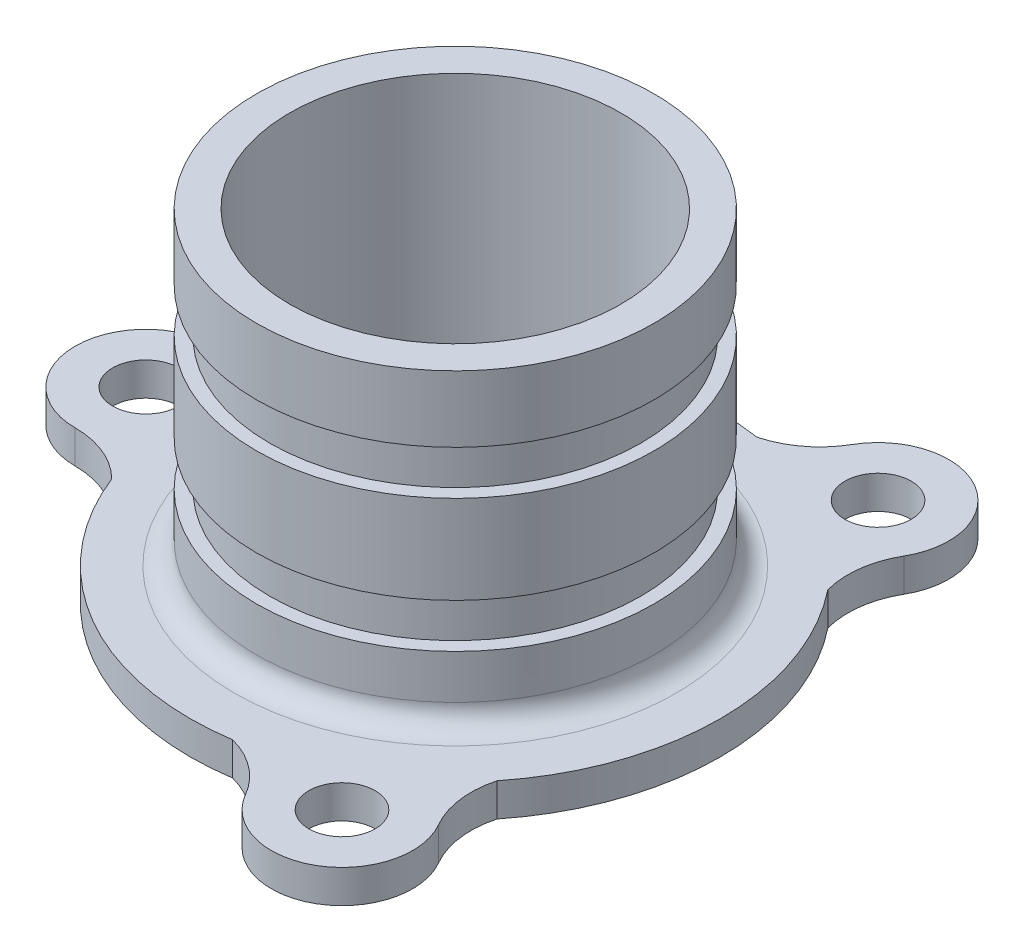
from build123d import *

# Parameters (mm, degrees)
SKETCH2_R           = 37.5
SKETCH2_R_2         = 7.5
BOSS_EXTRUDE1_DEPTH = 7.5
SKETCH3_R           = 45
SKETCH3_R_2         = 37.5
BOSS_EXTRUDE2_DEPTH = 15
SKETCH4_R           = 42
SKETCH4_R_2         = 37.5
BOSS_EXTRUDE3_DEPTH = 10
SKETCH5_R           = 45
SKETCH5_R_2         = 42
SKETCH5_R_3         = 37.5
BOSS_EXTRUDE4_DEPTH = 20
SKETCH6_R           = 42
SKETCH6_R_2         = 37.5
BOSS_EXTRUDE5_DEPTH = 10
SKETCH7_R           = 45
SKETCH7_R_2         = 37.5
BOSS_EXTRUDE6_DEPTH = 15
FILLET1_R           = 5


with BuildPart() as part:
    # Sketch2 → Boss-Extrude1 (new body)
    with BuildSketch(Plane(origin=(0, 0, 0), x_dir=(1, 0, 0), z_dir=(0, 1, 0))):
        with BuildLine():
            ThreePointArc((8.95472604, 59.328010935), (-30, 51.961524227), (-55.856927646, 21.908985233))
            ThreePointArc((-55.856927646, 21.908985233), (-62.363007589, 17.536247736), (-70.05, 16))
            ThreePointArc((-70.05, 16), (-86.05, 0), (-70.05, -16))
            ThreePointArc((-70.05, -16), (-62.363007589, -17.536247736), (-55.856927646, -21.908985233))
            ThreePointArc((-55.856927646, -21.908985233), (-30, -51.961524227), (8.95472604, -59.328010935))
            ThreePointArc((8.95472604, -59.328010935), (15.994667768, -62.776072696), (21.168593539, -68.665079535))
            ThreePointArc((21.168593539, -68.665079535), (43.025, -74.521485996), (48.881406461, -52.665079535))
            ThreePointArc((48.881406461, -52.665079535), (46.368339821, -45.23982496), (46.902201606, -37.419025702))
            ThreePointArc((46.902201606, -37.419025702), (60, 0), (46.902201606, 37.419025702))
            ThreePointArc((46.902201606, 37.419025702), (46.368339821, 45.23982496), (48.881406461, 52.665079535))
            ThreePointArc((48.881406461, 52.665079535), (43.025, 74.521485996), (21.168593539, 68.665079535))
            ThreePointArc((21.168593539, 68.665079535), (15.994667768, 62.776072696), (8.95472604, 59.328010935))
        make_face()
        with Locations(Location((0, 0, 0), (0, 0, 270))):
            Circle(SKETCH2_R, mode=Mode.SUBTRACT)
        with Locations(Location((-70.05, 0, 0), (0, 0, 270))):
            Circle(SKETCH2_R_2, mode=Mode.SUBTRACT)
        with Locations(Location((35.025, 60.665079535, 0), (0, 0, 270))):
            Circle(SKETCH2_R_2, mode=Mode.SUBTRACT)
        with Locations(Location((35.025, -60.665079535, 0), (0, 0, 270))):
            Circle(SKETCH2_R_2, mode=Mode.SUBTRACT)
    extrude(amount=BOSS_EXTRUDE1_DEPTH)

    # Sketch3 → Boss-Extrude2 (add)
    with BuildSketch(Plane(origin=(0, 7.5, 0), x_dir=(1, 0, 0), z_dir=(0, 1, 0))):
        with Locations(Location((0, 0, 0), (0, 0, 90))):
            Circle(SKETCH3_R)
        with Locations(Location((0, 0, 0), (0, 0, 270))):
            Circle(SKETCH3_R_2, mode=Mode.SUBTRACT)
    extrude(amount=BOSS_EXTRUDE2_DEPTH)

    # Sketch4 → Boss-Extrude3 (add)
    with BuildSketch(Plane(origin=(0, 22.5, 0), x_dir=(1, 0, 0), z_dir=(0, 1, 0))):
        with Locations(Location((0, 0, 0), (0, 0, 270))):
            Circle(SKETCH4_R)
        with Locations(Location((0, 0, 0), (0, 0, 270))):
            Circle(SKETCH4_R_2, mode=Mode.SUBTRACT)
    extrude(amount=BOSS_EXTRUDE3_DEPTH)

    # Sketch5 → Boss-Extrude4 (add)
    # profile 1 of 2: a face of its own
    with BuildSketch(Plane(origin=(0, 32.5, 0), x_dir=(1, 0, 0), z_dir=(0, 1, 0))):
        with Locations(Location((0, 0, 0), (0, 0, 90))):
            Circle(SKETCH5_R)
        with Locations(Location((0, 0, 0), (0, 0, 270))):
            Circle(SKETCH5_R_2, mode=Mode.SUBTRACT)
    # profile 2 of 2: a face of its own
    with BuildSketch(Plane(origin=(0, 32.5, 0), x_dir=(1, 0, 0), z_dir=(0, 1, 0))):
        with Locations(Location((0, 0, 0), (0, 0, 270))):
            Circle(SKETCH5_R_2)
        with Locations(Location((0, 0, 0), (0, 0, 270))):
            Circle(SKETCH5_R_3, mode=Mode.SUBTRACT)
    extrude(amount=BOSS_EXTRUDE4_DEPTH)

    # Sketch6 → Boss-Extrude5 (add)
    with BuildSketch(Plane(origin=(0, 52.5, 0), x_dir=(1, 0, 0), z_dir=(0, 1, 0))):
        with Locations(Location((0, 0, 0), (0, 0, 270))):
            Circle(SKETCH6_R)
        with Locations(Location((0, 0, 0), (0, 0, 270))):
            Circle(SKETCH6_R_2, mode=Mode.SUBTRACT)
    extrude(amount=BOSS_EXTRUDE5_DEPTH)

    # Sketch7 → Boss-Extrude6 (add)
    with BuildSketch(Plane(origin=(0, 62.5, 0), x_dir=(1, 0, 0), z_dir=(0, 1, 0))):
        with Locations(Location((0, 0, 0), (0, 0, 90))):
            Circle(SKETCH7_R)
        with Locations(Location((0, 0, 0), (0, 0, 270))):
            Circle(SKETCH7_R_2, mode=Mode.SUBTRACT)
    extrude(amount=BOSS_EXTRUDE6_DEPTH)

    # Fillet1
    fillet1_edges = [part.edges().sort_by_distance(p)[0] for p in [
        (0, 7.5, 45),
    ]]
    fillet(fillet1_edges, radius=FILLET1_R)


solid = part.part
